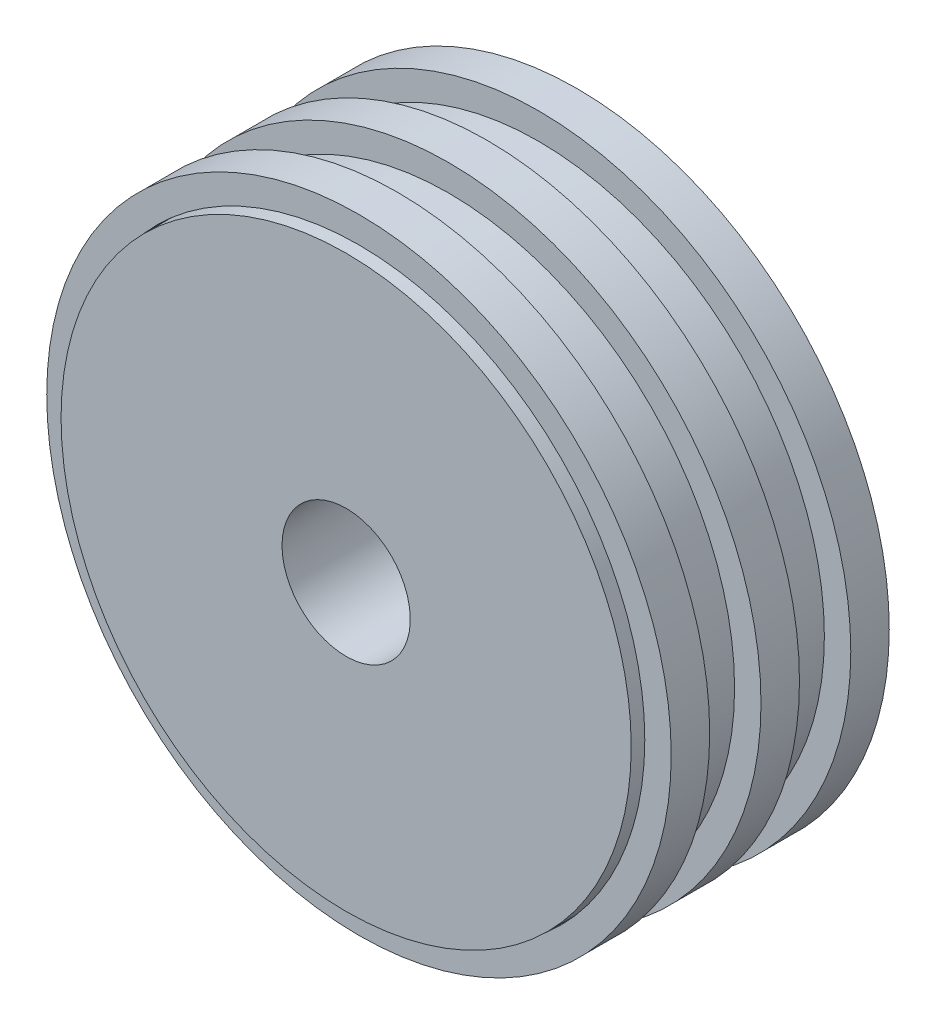
from build123d import *

# Parameters (mm, degrees)
SKETCH1_R           = 66.675
SKETCH1_R_2         = 15
BOSS_EXTRUDE1_DEPTH = 57
SKETCH2_R           = 73.025
SKETCH2_R_2         = 66.849881893
BOSS_EXTRUDE2_DEPTH = 9
LPATTERN1_COUNT     = 3
LPATTERN1_PITCH     = 21


with BuildPart() as part:
    # Sketch1 → Boss-Extrude1 (new body)
    with BuildSketch(Plane.XY):
        Circle(SKETCH1_R)
        Circle(SKETCH1_R_2, mode=Mode.SUBTRACT)
    extrude(amount=BOSS_EXTRUDE1_DEPTH)


with BuildPart() as body_2:
    # Sketch2 → Boss-Extrude2 (new body)
    with BuildSketch(Plane.XY.offset(54)):
        Circle(SKETCH2_R)
        Circle(SKETCH2_R_2, mode=Mode.SUBTRACT)
    boss_extrude2 = extrude(amount=-BOSS_EXTRUDE2_DEPTH)


with BuildPart() as lpattern1_1:
    # LPattern1: Boss-Extrude2 ×3
    with Locations(*[(0, 0, -i * LPATTERN1_PITCH) for i in range(1, LPATTERN1_COUNT)]):
        add(boss_extrude2)


solid = Compound([part.part, body_2.part, lpattern1_1.part])
